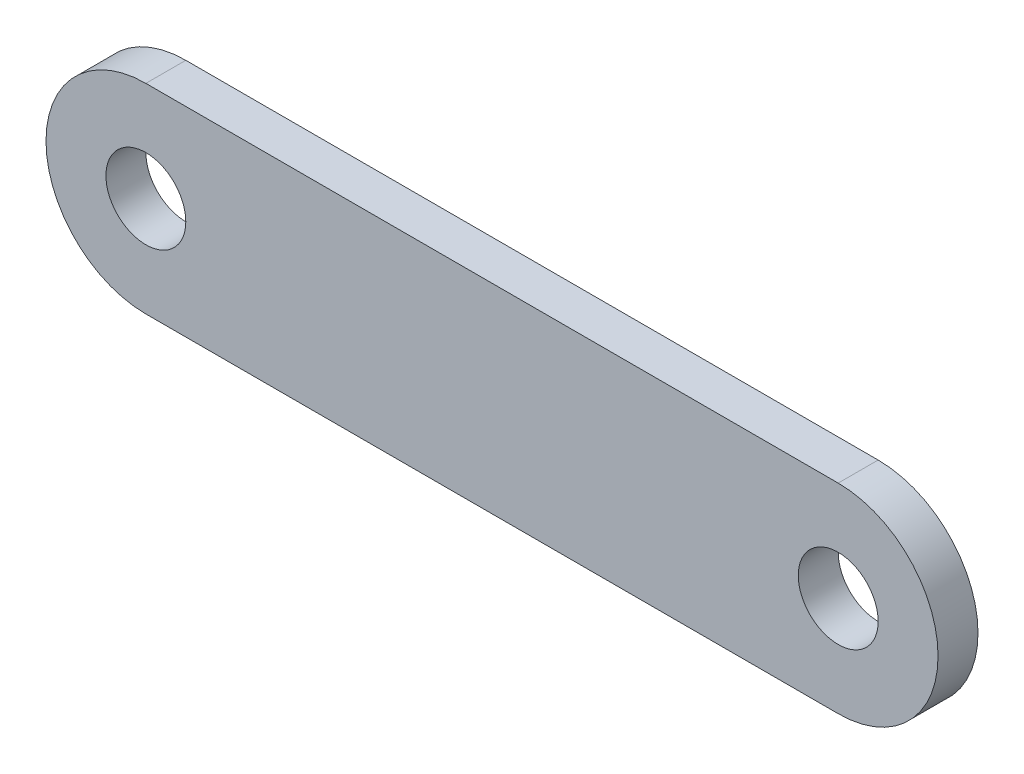
from build123d import *

# Parameters (mm, degrees)
ESQUISSE1_R        = 1.5
BOSS_EXTRU_1_DEPTH = 1.5


with BuildPart() as part:
    # Esquisse1 → Boss.-Extru.1 (new body)
    with BuildSketch(Plane.XY):
        with BuildLine():
            Line((0, 3.75), (26, 3.75))
            ThreePointArc((26, 3.75), (29.75, 0), (26, -3.75))
            Line((26, -3.75), (0, -3.75))
            ThreePointArc((0, -3.75), (-3.75, 0), (0, 3.75))
        make_face()
        Circle(ESQUISSE1_R, mode=Mode.SUBTRACT)
        with Locations((26, 0)):
            Circle(ESQUISSE1_R, mode=Mode.SUBTRACT)
    extrude(amount=BOSS_EXTRU_1_DEPTH)


solid = part.part
